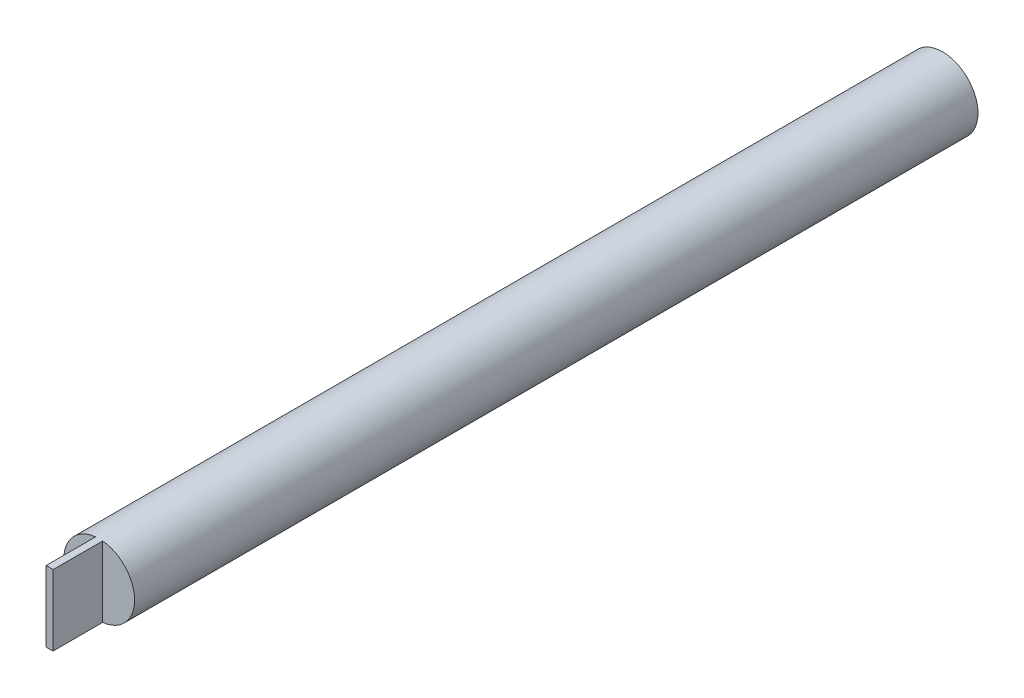
from build123d import *

# Parameters (mm, degrees)
ESBO_O1_R                = 5
RESSALTO_EXTRUS_O1_DEPTH = 63
SKETCH1_W                = 5
SKETCH1_H                = 14
CUT_EXTRUDE1_DEPTH       = 7


with BuildPart() as part:
    # Esboço1 → Ressalto-extrusão1 (new, symmetric)
    with BuildSketch(Plane.XY):
        with Locations((0, 100)):
            Circle(ESBO_O1_R)
    extrude(amount=RESSALTO_EXTRUS_O1_DEPTH, both=True)

    # Sketch1 → Cut-Extrude1 (cut)
    with BuildSketch(Plane.XY.offset(63)):
        with Locations((3, 100)):
            Rectangle(SKETCH1_W, SKETCH1_H)
        with Locations((-3, 100)):
            Rectangle(SKETCH1_W, SKETCH1_H)
    extrude(amount=-CUT_EXTRUDE1_DEPTH, mode=Mode.SUBTRACT)


solid = part.part
